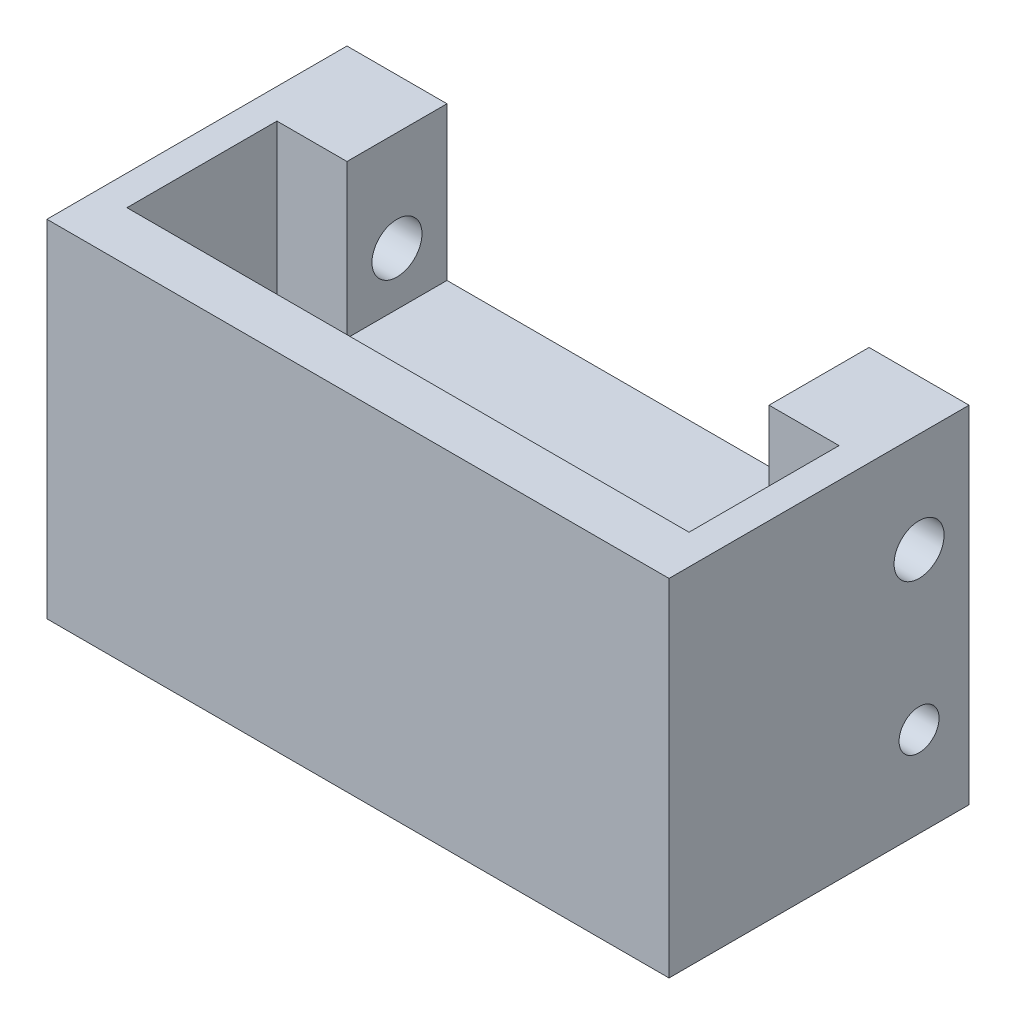
from build123d import *

# Parameters (mm, degrees)
SKETCH1_W             = 12.7
SKETCH1_H             = 43.942
BOSS_EXTRUDE1_DEPTH   = 12.7
BOSS_EXTRUDE1_2_DEPTH = 12.7
SKETCH2_R             = 3.175
SKETCH2_R_2           = 2.54
CUT_EXTRUDE1_DEPTH    = 87.166453569
BOSS_EXTRUDE3_REACH   = 76.696
SKETCH4_W             = 12.7
SKETCH4_H             = 5.08
SKETCH5_W             = 3.81
SKETCH5_H             = 43.942
BOSS_EXTRUDE4_DEPTH   = 19.05
SKETCH6_W             = 78.994
SKETCH6_H             = 43.942
BOSS_EXTRUDE5_DEPTH   = 6.35


with BuildPart() as part:
    # Sketch1 → Boss-Extrude1 (new body)
    with BuildSketch(Plane.XY):
        with Locations((-13.235289256, 10.018305785)):
            Rectangle(SKETCH1_W, SKETCH1_H)
    extrude(amount=BOSS_EXTRUDE1_DEPTH)


with BuildPart() as body_2:
    # Sketch1 → Boss-Extrude1 2 (new body)
    with BuildSketch(Plane.XY):
        with Locations((53.058710744, 10.018305785)):
            Rectangle(SKETCH1_W, SKETCH1_H)
    extrude(amount=BOSS_EXTRUDE1_2_DEPTH)


with BuildPart() as cut_extrude1_tool:
    # Sketch2 → Cut-Extrude1 (new, through all)
    with BuildSketch(Plane.ZY.offset(19.585289256)):
        with Locations(Location((6.35, 19.289305785, 0), (0, 0, 270))):
            Circle(SKETCH2_R)
        with Locations(Location((6.35, -0.522694215, 0), (0, 0, 270))):
            Circle(SKETCH2_R_2)
    extrude(amount=-CUT_EXTRUDE1_DEPTH)


with BuildPart() as part_1:
    add(part.part)

    # Cut-Extrude1: cut by cut_extrude1_tool
    add(cut_extrude1_tool.part, mode=Mode.SUBTRACT)


with BuildPart() as body_2_1:
    add(body_2.part)

    # Cut-Extrude1: cut by cut_extrude1_tool
    add(cut_extrude1_tool.part, mode=Mode.SUBTRACT)

    # Sketch4 → Boss-Extrude3 (add, up to next)
    with BuildSketch(Plane(origin=(-6.885289256, 0, 0), x_dir=(0, 0, -1), z_dir=(1, 0, 0)), mode=Mode.PRIVATE) as boss_extrude3_sk1:
        with Locations((-6.35, 10.018305785)):
            Rectangle(SKETCH4_W, SKETCH4_H)
    boss_extrude3_tool1 = extrude(boss_extrude3_sk1.sketch, amount=BOSS_EXTRUDE3_REACH, mode=Mode.PRIVATE) - body_2_1.part

    add(part_1.part)  # Boss-Extrude3 merges part
    add(boss_extrude3_tool1.solids().sort_by_distance((-6.885289, 10.018306, 6.35))[0])

    # Sketch5 → Boss-Extrude4 (add)
    with BuildSketch(Plane.XY.offset(12.7)):
        with Locations((-17.680289256, 10.018305785)):
            Rectangle(SKETCH5_W, SKETCH5_H)
        with Locations((57.503710744, 10.018305785)):
            Rectangle(SKETCH5_W, SKETCH5_H)
    extrude(amount=BOSS_EXTRUDE4_DEPTH)

    # Sketch6 → Boss-Extrude5 (add)
    with BuildSketch(Plane.XY.offset(31.75)):
        with Locations((19.911710744, 10.018305785)):
            Rectangle(SKETCH6_W, SKETCH6_H)
    extrude(amount=BOSS_EXTRUDE5_DEPTH)


solid = body_2_1.part
